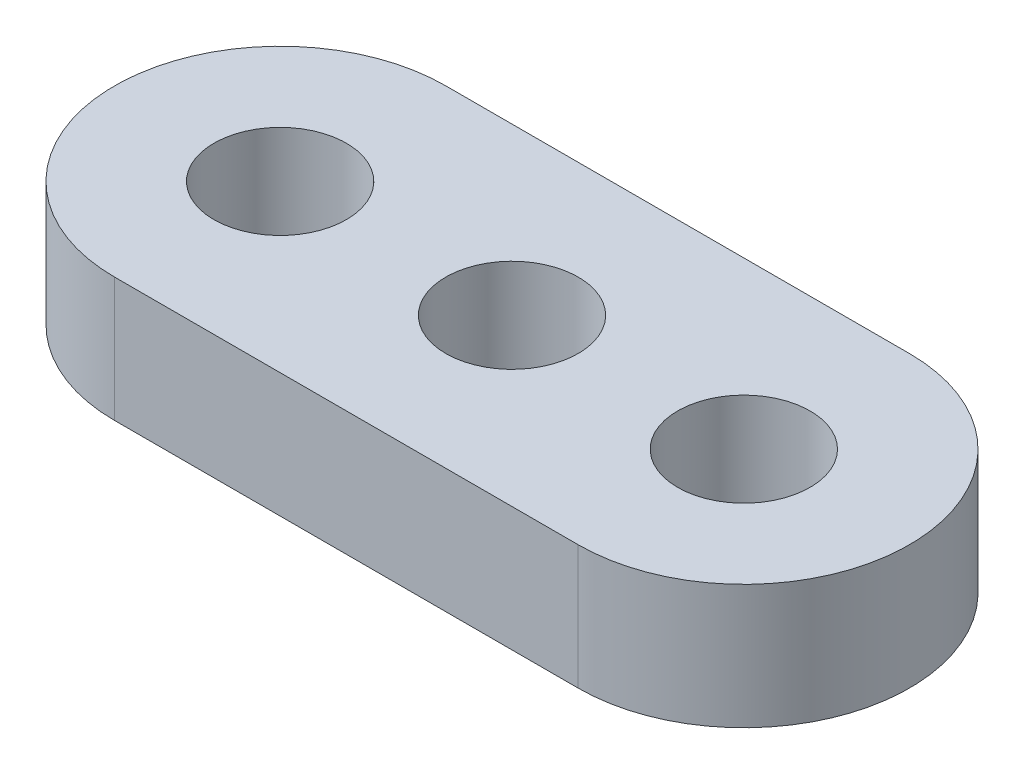
from build123d import *

# Parameters (mm, degrees)
SKETCH_1_R      = 1.6
EXTRUDE_1_DEPTH = 3


with BuildPart() as part:
    # ｽｹｯﾁ1 → ﾎﾞｽ - 押し出し1 (new body)
    with BuildSketch(Plane(origin=(0, 0, 0), x_dir=(1, 0, 0), z_dir=(0, 1, 0))):
        with BuildLine():
            Line((-5.6, 4), (5.6, 4))
            ThreePointArc((5.6, 4), (9.6, 0), (5.6, -4))
            Line((5.6, -4), (-5.6, -4))
            ThreePointArc((-5.6, -4), (-9.6, 0), (-5.6, 4))
        make_face()
        with Locations(Location((-5.6, 0, 0), (0, 0, 270))):
            Circle(SKETCH_1_R, mode=Mode.SUBTRACT)
        with Locations(Location((5.6, 0, 0), (0, 0, 270))):
            Circle(SKETCH_1_R, mode=Mode.SUBTRACT)
        with Locations(Location((0, 0, 0), (0, 0, 270))):
            Circle(SKETCH_1_R, mode=Mode.SUBTRACT)
    extrude(amount=EXTRUDE_1_DEPTH)


solid = part.part
